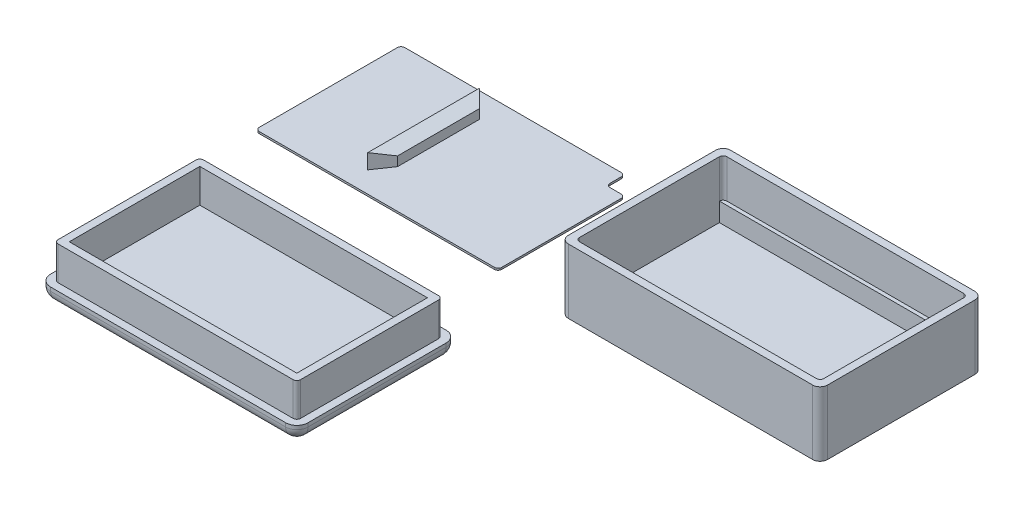
from build123d import *

# Parameters (mm, degrees)
BOSS_EXTRUDE1_DEPTH  = 0.5
FILLET2_R            = 1
FILLET3_R            = 1
FILLET4_R            = 1
FILLET5_R            = 1
SKETCH3_W            = 69.5
SKETCH3_H            = 43.5
SKETCH3_W_2          = 65.5
SKETCH3_H_2          = 39.5
BOSS_EXTRUDE2_DEPTH  = 17.3
SKETCH5_W            = 69.5
SKETCH5_H            = 43.5
BOSS_EXTRUDE3_DEPTH  = 2
FILLET6_R            = 1
FILLET7_R            = 1
FILLET8_R            = 1
FILLET9_R            = 1
BOSS_EXTRUDE5_DEPTH  = 9
FILLET12_R           = 1
FILLET13_R           = 1
BOSS_EXTRUDE6_DEPTH  = 4
SKETCH9_W            = 61
SKETCH9_H            = 35
BOSS_EXTRUDE7_DEPTH  = 9
FILLET15_R           = 3
BOSS_EXTRUDE8_DEPTH  = 30
BOSS_EXTRUDE9_REACH  = 127.091
FILLET16_R           = 2
BOSS_EXTRUDE10_DEPTH = 5


with BuildPart() as part:
    # Sketch1 → Boss-Extrude1 (new body)
    with BuildSketch(Plane(origin=(0, 0, 0), x_dir=(1, 0, 0), z_dir=(0, 1, 0))):
        Polygon((-58.370860927, -20.40397351), (-58.370860927, 18.59602649), (1.629139073, 18.59602649), (1.629139073, 13.59602649), (6.629139073, 13.59602649), (6.629139073, -20.40397351), align=None)
    extrude(amount=BOSS_EXTRUDE1_DEPTH)

    # Fillet2
    fillet2_edges = [part.edges().sort_by_distance(p)[0] for p in [
        (6.629139073, 0.25, 20.40397351),
    ]]
    fillet(fillet2_edges, radius=FILLET2_R)

    # Fillet3
    fillet3_edges = [part.edges().sort_by_distance(p)[0] for p in [
        (1.629139073, 0.25, -18.59602649),
        (1.629139073, 0.25, -13.59602649),
        (6.629139073, 0.25, -13.59602649),
    ]]
    fillet(fillet3_edges, radius=FILLET3_R)

    # Fillet4
    fillet4_edges = [part.edges().sort_by_distance(p)[0] for p in [
        (-58.370860927, 0.25, -18.59602649),
    ]]
    fillet(fillet4_edges, radius=FILLET4_R)

    # Fillet5
    fillet5_edges = [part.edges().sort_by_distance(p)[0] for p in [
        (-58.370860927, 0.25, 20.40397351),
    ]]
    fillet(fillet5_edges, radius=FILLET5_R)


with BuildPart() as body_2:
    # Sketch3 → Boss-Extrude2 (new body)
    with BuildSketch(Plane.XZ):
        with Locations((59.667093339, 0.128619439)):
            Rectangle(SKETCH3_W, SKETCH3_H)
        with Locations((59.667093339, 0.128619439)):
            Rectangle(SKETCH3_W_2, SKETCH3_H_2, mode=Mode.SUBTRACT)
    extrude(amount=-BOSS_EXTRUDE2_DEPTH)

    # Sketch5 → Boss-Extrude3 (add)
    with BuildSketch(Plane.XZ):
        with Locations((59.667093339, 0.128619439)):
            Rectangle(SKETCH5_W, SKETCH5_H)
    extrude(amount=-BOSS_EXTRUDE3_DEPTH)

    # Fillet6
    fillet6_edges = [body_2.edges().sort_by_distance(p)[0] for p in [
        (26.917093339, 9.65, 19.878619439),
    ]]
    fillet(fillet6_edges, radius=FILLET6_R)

    # Fillet7
    fillet7_edges = [body_2.edges().sort_by_distance(p)[0] for p in [
        (26.917093339, 9.65, -19.621380561),
    ]]
    fillet(fillet7_edges, radius=FILLET7_R)

    # Fillet8
    fillet8_edges = [body_2.edges().sort_by_distance(p)[0] for p in [
        (92.417093339, 9.65, -19.621380561),
    ]]
    fillet(fillet8_edges, radius=FILLET8_R)

    # Fillet9
    fillet9_edges = [body_2.edges().sort_by_distance(p)[0] for p in [
        (92.417093339, 9.65, 19.878619439),
    ]]
    fillet(fillet9_edges, radius=FILLET9_R)

    # Fillet16
    fillet16_edges = [body_2.edges().sort_by_distance(p)[0] for p in [
        (94.417093339, 8.65, 21.878619439),
        (94.417093339, 8.65, -21.621380561),
        (24.917093339, 8.65, -21.621380561),
        (24.917093339, 8.65, 21.878619439),
    ]]
    fillet(fillet16_edges, radius=FILLET16_R)

    # Sketch21 → Boss-Extrude10 (add)
    with BuildSketch(Plane(origin=(0, 2, 0), x_dir=(1, 0, 0), z_dir=(0, 1, 0))):
        with BuildLine():
            Line((26.917093339, -18.878619439), (87.417093339, -18.878619439))
            Line((87.417093339, -18.878619439), (87.417093339, 18.621380561))
            Line((87.417093339, 18.621380561), (26.917093339, 18.621380561))
            ThreePointArc((26.917093339, 18.621380561), (27.209986558, 19.328487343), (27.917093339, 19.621380561))
            Line((27.917093339, 19.621380561), (91.417093339, 19.621380561))
            ThreePointArc((91.417093339, 19.621380561), (92.12420012, 19.328487343), (92.417093339, 18.621380561))
            Line((92.417093339, 18.621380561), (92.417093339, -18.878619439))
            ThreePointArc((92.417093339, -18.878619439), (92.12420012, -19.58572622), (91.417093339, -19.878619439))
            Line((91.417093339, -19.878619439), (27.917093339, -19.878619439))
            ThreePointArc((27.917093339, -19.878619439), (27.209986558, -19.58572622), (26.917093339, -18.878619439))
        make_face()
    extrude(amount=BOSS_EXTRUDE10_DEPTH)


with BuildPart() as body_3:
    # Sketch7 → Boss-Extrude5 (new body)
    with BuildSketch(Plane(origin=(-22.905465396, 0.5, 42.53872145), x_dir=(1, 0, 0), z_dir=(0, 1, 0))):
        Polygon((-36.359783771, -30.922325969), (-36.359783771, 8.077674031), (23.640216229, 8.077674031), (28.640216229, 8.077674031), (28.640216229, 3.077674031), (28.640216229, -30.922325969), align=None)
    extrude(amount=-BOSS_EXTRUDE5_DEPTH)

    # Fillet12
    fillet12_edges = [body_3.edges().sort_by_distance(p)[0] for p in [
        (5.734750833, -4, 34.461047419),
        (5.734750833, -4, 73.461047419),
    ]]
    fillet(fillet12_edges, radius=FILLET12_R)

    # Fillet13
    fillet13_edges = [body_3.edges().sort_by_distance(p)[0] for p in [
        (-59.265249167, -4, 73.461047419),
        (-59.265249167, -4, 34.461047419),
    ]]
    fillet(fillet13_edges, radius=FILLET13_R)

    # Sketch8 → Boss-Extrude6 (add)
    with BuildSketch(Plane(origin=(0, -8.5, 0), x_dir=(-1, 0, 0), z_dir=(0, -1, 0))):
        with BuildLine():
            Line((58.265249167, -32.461047419), (-4.734750833, -32.461047419))
            ThreePointArc((-4.734750833, -32.461047419), (-6.856071177, -33.339727075), (-7.734750833, -35.461047419))
            Line((-7.734750833, -35.461047419), (-7.734750833, -72.461047419))
            ThreePointArc((-7.734750833, -72.461047419), (-6.856071177, -74.582367762), (-4.734750833, -75.461047419))
            Line((-4.734750833, -75.461047419), (58.265249167, -75.461047419))
            ThreePointArc((58.265249167, -75.461047419), (60.38656951, -74.582367762), (61.265249167, -72.461047419))
            Line((61.265249167, -72.461047419), (61.265249167, -35.461047419))
            ThreePointArc((61.265249167, -35.461047419), (60.38656951, -33.339727075), (58.265249167, -32.461047419))
        make_face()
    extrude(amount=BOSS_EXTRUDE6_DEPTH)


with BuildPart() as body_4:
    # Sketch9 → Boss-Extrude7 (new body)
    with BuildSketch(Plane(origin=(0, 0.5, 0), x_dir=(1, 0, 0), z_dir=(0, 1, 0))):
        with Locations((-26.765249167, -53.961047419)):
            Rectangle(SKETCH9_W, SKETCH9_H)
    extrude(amount=-BOSS_EXTRUDE7_DEPTH)


with BuildPart() as body_3_1:
    add(body_3.part)

    # Combine1: cut body 4
    add(body_4.part, mode=Mode.SUBTRACT)

    # Fillet15
    fillet15_edges = [body_3_1.edges().sort_by_distance(p)[0] for p in [
        (-60.38656951, -12.5, 33.339727075),
        (-26.765249167, -12.5, 32.461047419),
        (6.856071177, -12.5, 33.339727075),
        (7.734750833, -12.5, 53.961047419),
        (6.856071177, -12.5, 74.582367762),
        (-26.765249167, -12.5, 75.461047419),
        (-60.38656951, -12.5, 74.582367762),
        (-61.265249167, -12.5, 53.961047419),
    ]]
    fillet(fillet15_edges, radius=FILLET15_R)


with BuildPart() as body_4_2:
    # Sketch19 → Boss-Extrude8 (new body)
    with BuildSketch(Plane.XY):
        Polygon((-18.723200044, 15.730603156), (-18.723200044, 19.730603156), (-14.723200044, 18.980603156), (-14.723200044, 16.480603156), align=None)
    extrude(amount=BOSS_EXTRUDE8_DEPTH)


with BuildPart() as body_5:
    # Boss-Extrude9: up to this plane
    boss_extrude9_end = Plane(origin=(-18.723200044, 15.730603156, 30), z_dir=(-0.1842885350501855, 0.982872186934322, 0))
    # Sketch20 → Boss-Extrude9 (new, up to the surface)
    with BuildSketch(Plane(origin=(0, 19.730603156, 0), x_dir=(-1, 0, 0), z_dir=(0, 1, 0)), mode=Mode.PRIVATE) as boss_extrude9_sk1:
        Polygon((18.723200044, 30), (14.723200044, 30), (14.723200044, 26), align=None)
    boss_extrude9_tool1 = split(extrude(boss_extrude9_sk1.sketch, amount=-BOSS_EXTRUDE9_REACH, mode=Mode.PRIVATE), bisect_by=boss_extrude9_end, keep=Keep.BOTH, mode=Mode.PRIVATE)
    add(boss_extrude9_tool1.solids().sort_by_distance((-16.056533, 19.730603, 28.666667))[0])
    # Sketch20 → Boss-Extrude9 (new, up to the surface)
    with BuildSketch(Plane(origin=(0, 19.730603156, 0), x_dir=(-1, 0, 0), z_dir=(0, 1, 0)), mode=Mode.PRIVATE) as boss_extrude9_sk2:
        Polygon((14.723200044, 0), (14.723200044, 4), (18.723200044, 0), align=None)
    boss_extrude9_tool2 = split(extrude(boss_extrude9_sk2.sketch, amount=-BOSS_EXTRUDE9_REACH, mode=Mode.PRIVATE), bisect_by=boss_extrude9_end, keep=Keep.BOTH, mode=Mode.PRIVATE)
    add(boss_extrude9_tool2.solids().sort_by_distance((-16.056533, 19.730603, 1.333333))[0])


with BuildPart() as body_4_2_1:
    add(body_4_2.part)

    # Combine2: cut body 5
    add(body_5.part, mode=Mode.SUBTRACT)


solid = Compound([part.part, body_2.part, body_3_1.part, body_4_2_1.part])
